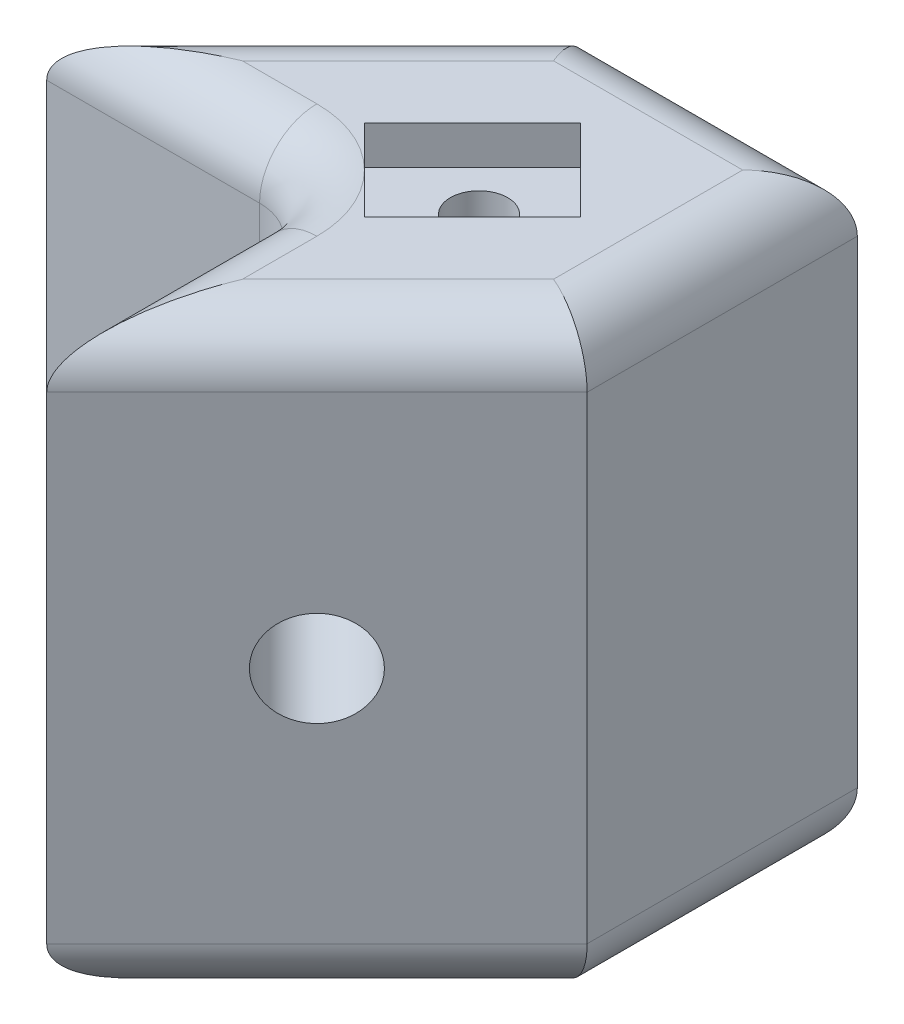
from build123d import *

# Parameters (mm, degrees)
BOSS_EXTRUDE3_DEPTH = 196.85
FILLET3_R           = 19.05
SKETCH5_R           = 15.875
CUT_EXTRUDE1_DEPTH  = 328.563997691
SKETCH6_R           = 9.525
CUT_EXTRUDE4_DEPTH  = 322.350155709
CUT_EXTRUDE5_DEPTH  = 12.7


with BuildPart() as part:
    # Sketch1 → Boss-Extrude3 (new body)
    with BuildSketch(Plane(origin=(0, 0, 0), x_dir=(1, 0, 0), z_dir=(0, 1, 0))):
        Polygon((0, 0), (-89.802561314, 0), (-179.605122525, -89.802561211), (-89.802561211, -89.802561211), (-89.802561211, -179.605122525), (0, -89.802561314), align=None)
    extrude(amount=-BOSS_EXTRUDE3_DEPTH)

    # Fillet3
    fillet3_edges = [part.edges().sort_by_distance(p)[0] for p in [
        (-44.901280605, -196.85, 134.703841919),
        (-89.802561211, -98.425, 89.802561211),
        (0, -196.85, 44.901280657),
        (-44.901280657, -196.85, 0),
        (-134.703841919, -196.85, 44.901280605),
        (-134.703841868, -196.85, 89.802561211),
        (-134.703841919, 0, 44.901280605),
        (-44.901280657, 0, 0),
        (0, 0, 44.901280657),
        (-89.802561211, -196.85, 134.703841868),
        (-44.901280605, 0, 134.703841919),
        (-89.802561211, 0, 134.703841868),
        (-134.703841868, 0, 89.802561211),
    ]]
    fillet(fillet3_edges, radius=FILLET3_R)

    # Sketch5 → Cut-Extrude1 (cut, through all)
    with BuildSketch(Plane(origin=(44.901280657, 0, 44.901280657), x_dir=(0.7071067811865475, 0, -0.7071067811865477), z_dir=(0.7071067811865477, 0, 0.7071067811865475))):
        with Locations((-127.000000073, -98.552)):
            Circle(SKETCH5_R)
    extrude(amount=-CUT_EXTRUDE1_DEPTH, mode=Mode.SUBTRACT)

    # Sketch6 → Cut-Extrude4 (cut, through all)
    with BuildSketch(Plane(origin=(0, 0, 0), x_dir=(1, 0, 0), z_dir=(0, 1, 0))):
        with Locations(Location((-62.861792847, -62.861792847, 0), (0, 0, 270))):
            Circle(SKETCH6_R)
    extrude(amount=-CUT_EXTRUDE4_DEPTH, mode=Mode.SUBTRACT)

    # Sketch7 → Cut-Extrude5 (cut)
    with BuildSketch(Plane(origin=(0, 0, 0), x_dir=(1, 0, 0), z_dir=(0, 1, 0))):
        Polygon((-32.520384182, -59.461152545), (-68.441408666, -95.382177029), (-95.382177029, -68.441408666), (-59.461152545, -32.520384182), align=None)
    extrude(amount=-CUT_EXTRUDE5_DEPTH, mode=Mode.SUBTRACT)


solid = part.part
